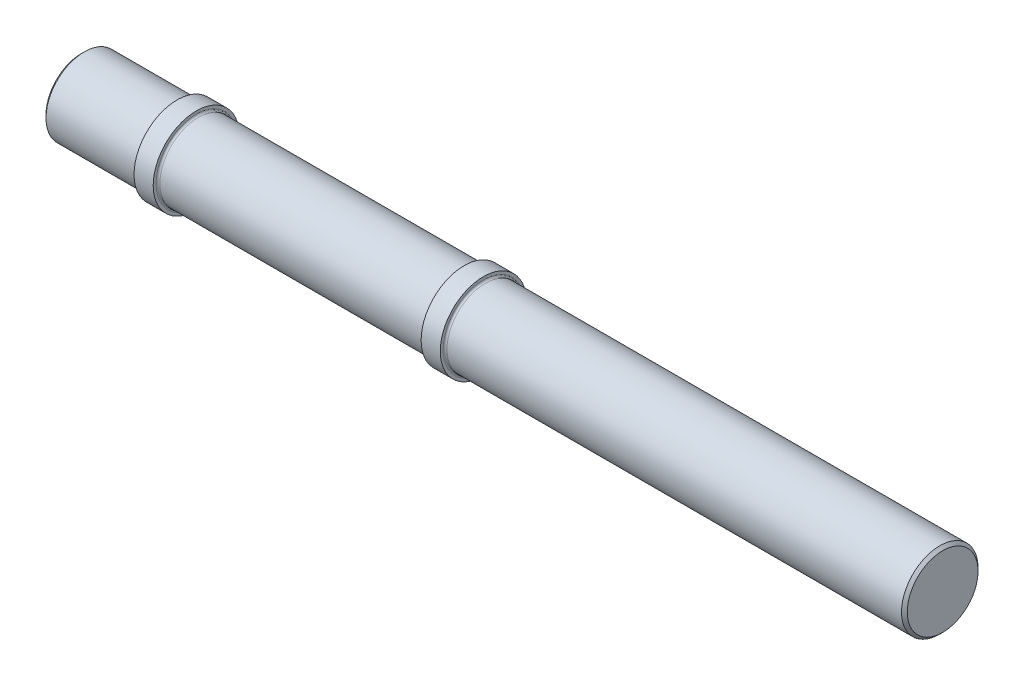
from build123d import *

# Parameters (mm, degrees)
SKETCH1_W     = 10
SKETCH1_H     = 4
SKETCH1_W_2   = 8
SKETCH1_W_3   = 12
SKETCH1_W_4   = 38
FILLET1_R     = 0.2
CHAMFER1_SIZE = 0.3


with BuildPart() as part:
    # Sketch1 → Revolve1 (revolve)
    with BuildSketch(Plane.XY, mode=Mode.PRIVATE) as revolve1_sk:
        with Locations((5, 2)):
            Rectangle(SKETCH1_W, SKETCH1_H)
        Polygon((10, 4.5), (10, 4), (10, 0), (12, 0), (12, 4), (12, 4.5), align=None)
        with Locations((16, 2)):
            Rectangle(SKETCH1_W_2, SKETCH1_H)
        with Locations((26, 2)):
            Rectangle(SKETCH1_W_3, SKETCH1_H)
        with Locations((36, 2)):
            Rectangle(SKETCH1_W_2, SKETCH1_H)
        Polygon((40, 4), (40, 0), (42, 0), (42, 4), (42, 4.5), (40, 4.5), align=None)
        with Locations((47, 2)):
            Rectangle(SKETCH1_W, SKETCH1_H)
        with Locations((71, 2)):
            Rectangle(SKETCH1_W_4, SKETCH1_H)
    revolve(revolve1_sk.sketch.rotate(Axis((0, 0, 0), (1, 0, 0)), 90), axis=Axis((0, 0, 0), (1, 0, 0)))

    # Fillet1
    fillet1_edges = [part.edges().sort_by_distance(p)[0] for p in [
        (10, 0, -4),
        (12, 0, -4),
        (40, 0, -4),
        (42, 0, -4),
    ]]
    fillet(fillet1_edges, radius=FILLET1_R)

    # Chamfer1
    chamfer1_edges = [part.edges().sort_by_distance(p)[0] for p in [
        (90, 0, -4),
        (0, 0, -4),
    ]]
    chamfer(chamfer1_edges, length=CHAMFER1_SIZE)


solid = part.part
